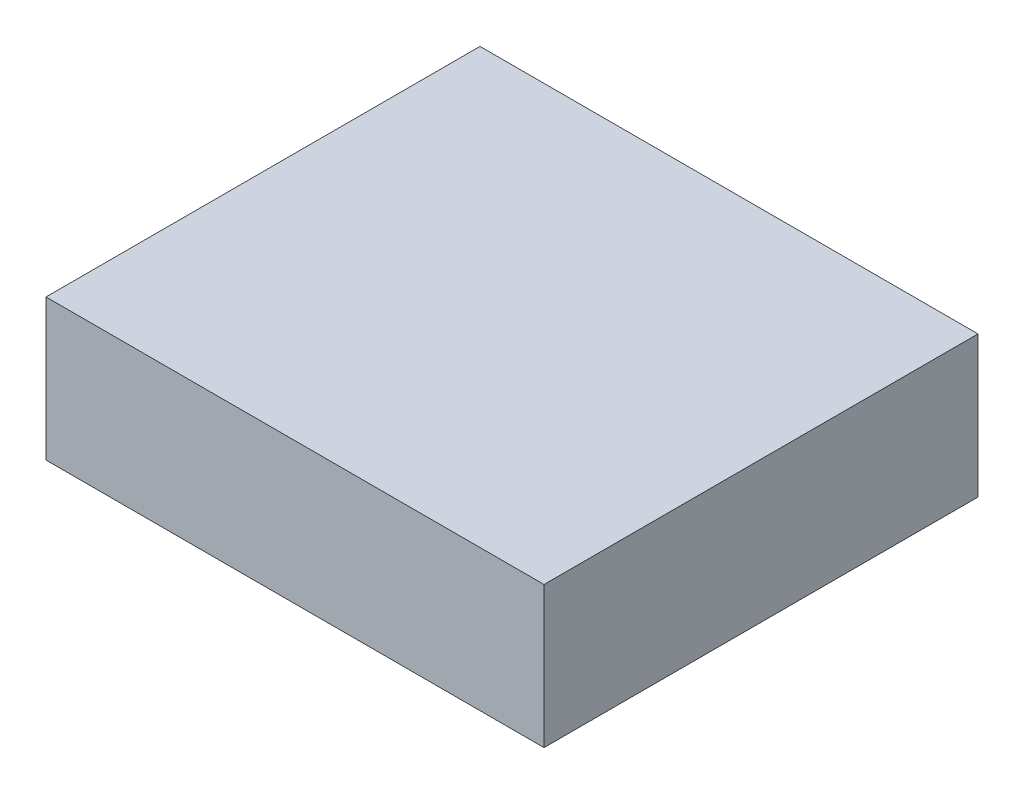
from build123d import *

# Parameters (mm, degrees)
SKETCH1_W        = 11280
SKETCH1_H        = 3200
DIMENSIONS_DEPTH = 4915


with BuildPart() as part:
    # Sketch1 → Dimensions (new, symmetric)
    with BuildSketch(Plane.XY):
        with Locations((0, 800)):
            Rectangle(SKETCH1_W, SKETCH1_H)
    extrude(amount=DIMENSIONS_DEPTH, both=True)


solid = part.part
